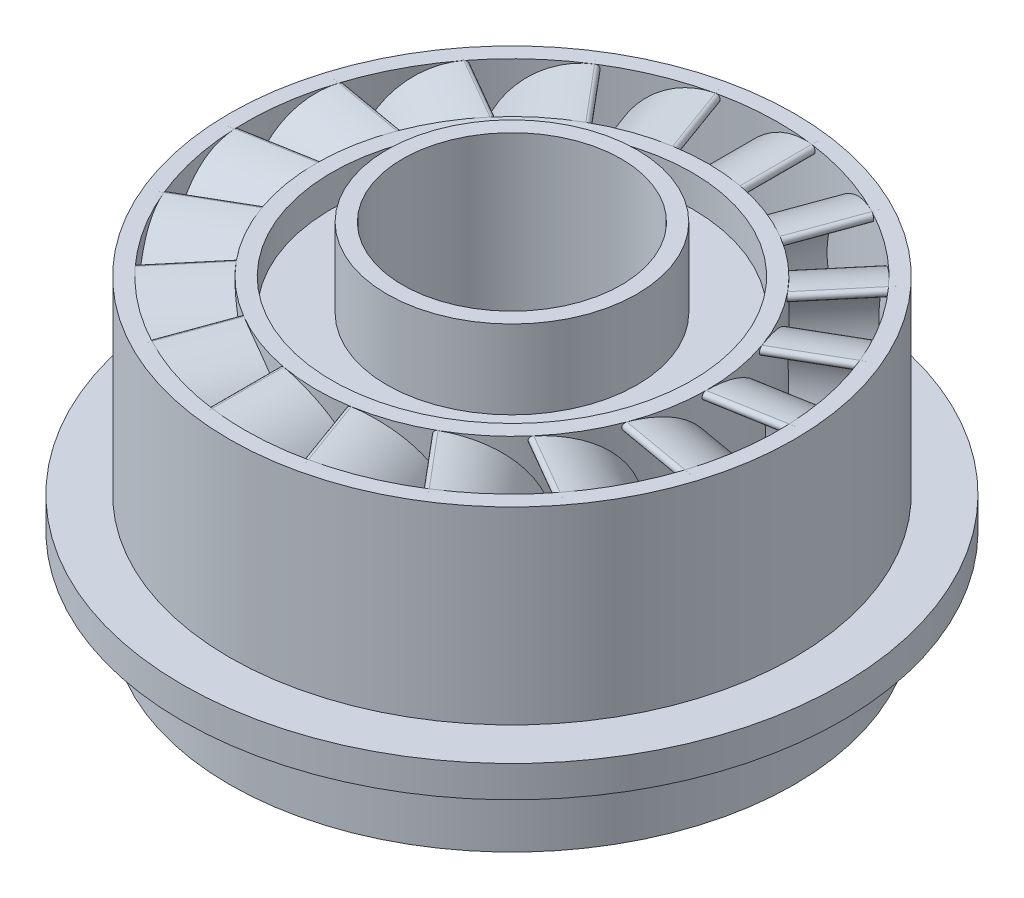
from build123d import *

# Parameters (mm, degrees)
Y_KSEKLIK_EKSTR_ZYON2_DEPTH = 10.4
DAIRESEL_KAPLAMA1_COUNT     = 18


with BuildPart() as part:
    # Çizim1 → Döndür1 (revolve)
    with BuildSketch(Plane.XY, mode=Mode.PRIVATE) as d_nd_r1_sk:
        Polygon((-24.9, 0), (-24.9, 14), (-22.9, 14), (-22.9, 10), (-15.9, 10), (-15.9, 20), (-13.9, 20), (-13.9, 0), (-15.9, 0), (-15.9, 5), (-22.9, 5), (-22.9, 0), align=None)
    revolve(d_nd_r1_sk.sketch.rotate(Axis((0, 0, 0), (0, 1, 0)), 270), axis=Axis((0, 0, 0), (0, 1, 0)))

    # Çizim2 → Yükseklik-Ekstrüzyon2 (add)
    with BuildSketch(Plane.XY.offset(24)):
        with BuildLine():
            ThreePointArc((-4.531475723, 13.000012939), (3.079568316, 9.092843704), (4.46252582, 0.650012939))
            ThreePointArc((4.46252582, 0.650012939), (4.789478413, 0.023034469), (5.416456883, 0.349987061))
            ThreePointArc((5.416456883, 0.349987061), (3.887924905, 9.681536855), (-4.524281664, 13.999987061))
            ThreePointArc((-4.524281664, 13.999987061), (-5.027865755, 13.503597029), (-4.531475723, 13.000012939))
        make_face()
    y_kseklik_ekstr_zyon2 = extrude(amount=Y_KSEKLIK_EKSTR_ZYON2_DEPTH)

    # Dairesel Kaplama1: Yükseklik-Ekstrüzyon2 ×18 about axis
    dairesel_kaplama1_axis = Axis((0, 0, 0), (0, 1, 0))
    for i in range(1, DAIRESEL_KAPLAMA1_COUNT):
        add(y_kseklik_ekstr_zyon2.rotate(dairesel_kaplama1_axis, i * 360 / DAIRESEL_KAPLAMA1_COUNT))

    # Çizim3 → Döndür2 (revolve)
    with BuildSketch(Plane(origin=(0, 0, 0), x_dir=(0, 0, -1), z_dir=(1, 0, 0)), mode=Mode.PRIVATE) as d_nd_r2_sk:
        Polygon((33.9, 13.999987061), (33.9, -24.000012939), (35.9, -24.000012939), (35.9, -14.000012939), (41.9, -14.000012939), (41.9, -10.000012939), (35.9, -10.000012939), (35.9, 13.999987061), align=None)
    revolve(d_nd_r2_sk.sketch.rotate(Axis((0, 31.368196431, 0), (0, -1, 0)), 180), axis=Axis((0, 31.368196431, 0), (0, -1, 0)))


solid = part.part
